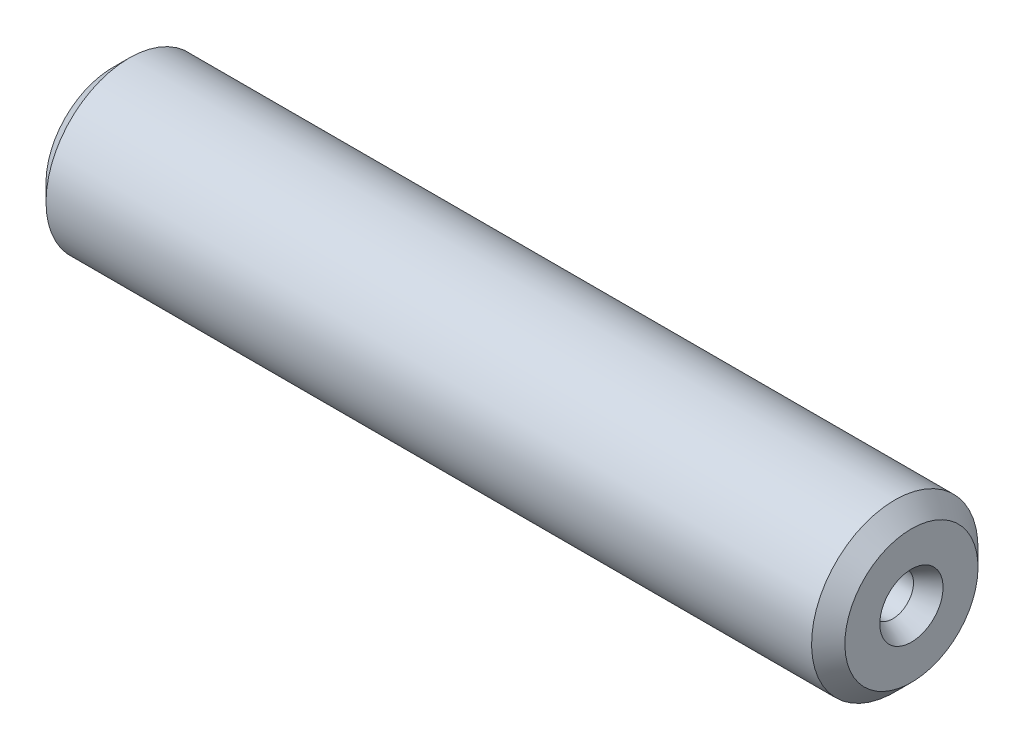
from build123d import *

# Parameters (mm, degrees)
CHAMFER1_SIZE = 1


with BuildPart() as part:
    # Sketch1 → Revolve1 (revolve)
    with BuildSketch(Plane.XY):
        Polygon((0, 1.9), (0, 5), (-48, 5), (-48, 0), (-4, 0), (-3.248924226, 1.25), (-1.125833025, 1.25), align=None)
    revolve(axis=Axis((0, 0, 0), (-1, 0, 0)))

    # Chamfer1
    chamfer1_edges = [part.edges().sort_by_distance(p)[0] for p in [
        (0, -5, 0),
        (-48, -5, 0),
    ]]
    chamfer(chamfer1_edges, length=CHAMFER1_SIZE)


solid = part.part
